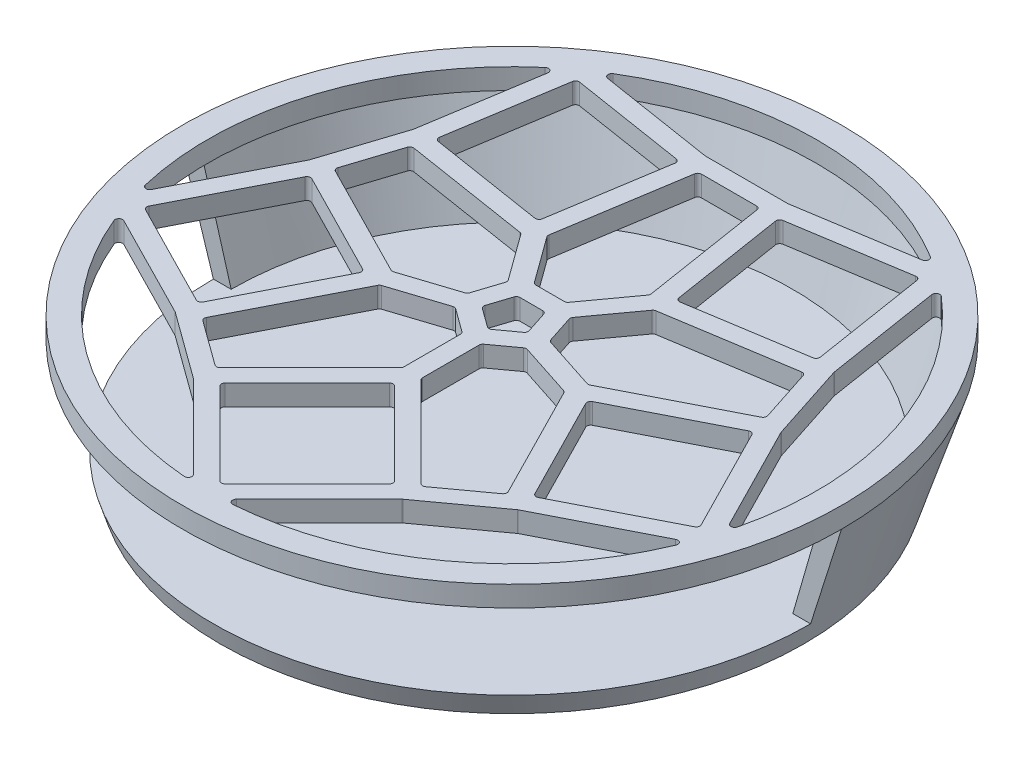
from build123d import *

# Parameters (mm, degrees)
ENL_V_MAT_EXTRU_3_REACH = 66.917
ENL_V_MAT_EXTRU_4_DEPTH = 2.75
ENL_V_MAT_EXTRU_5_DEPTH = 2.75
CONG_2_R                = 0.5


with BuildPart() as part:
    # Esquisse4 → Révolution1 (revolve)
    with BuildSketch(Plane.XY, mode=Mode.PRIVATE) as r_volution1_sk:
        Polygon((0, 0), (-39, 0), (-44, 15.75), (-44, 18.5), (0, 18.5), align=None)
    revolve(r_volution1_sk.sketch.rotate(Axis((0, 0, 0), (0, 1, 0)), 270), axis=Axis((0, 0, 0), (0, 1, 0)))

    # Esquisse5 → Enlèvement de matière-Lissage2 section 0
    with BuildSketch(Plane(origin=(0, 2.75, 0), x_dir=(1, 0, 0), z_dir=(0, 1, 0))):
        with BuildLine():
            Line((44, -44), (-44, -44))
            Line((-44, -44), (-44, 0))
            Line((-44, 0), (-37.5, 0))
            ThreePointArc((-37.5, 0), (0, 37.5), (37.5, 0))
            Line((37.5, 0), (44, 0))
            Line((44, 0), (44, -44))
        make_face()
    # Esquisse6 → Enlèvement de matière-Lissage2 section 1
    with BuildSketch(Plane(origin=(0, 15.75, 0), x_dir=(1, 0, 0), z_dir=(0, 1, 0))):
        with BuildLine():
            Line((-44, -44), (44, -44))
            Line((44, -44), (44, 0))
            Line((44, 0), (41.25, 0))
            ThreePointArc((41.25, 0), (0, 41.25), (-41.25, 0))
            Line((-41.25, 0), (-44, 0))
            Line((-44, 0), (-44, -44))
        make_face()
    loft(mode=Mode.SUBTRACT)

    # Esquisse7 → Enlèv. mat.-Extru.3 (cut, up to next)
    with BuildSketch(Plane(origin=(0, 18.5, 0), x_dir=(1, 0, 0), z_dir=(0, 1, 0)), mode=Mode.PRIVATE) as enl_v_mat_extru_3_sk1:
        Polygon((0, -15.665476221), (-11.66726189, -27.33273811), (0, -39), (11.66726189, -27.33273811), align=None)
    enl_v_mat_extru_3_tool1 = extrude(enl_v_mat_extru_3_sk1.sketch, amount=-ENL_V_MAT_EXTRU_3_REACH, mode=Mode.PRIVATE) & part.part
    # Esquisse7 → Enlèv. mat.-Extru.3 (cut, up to next)
    with BuildSketch(Plane(origin=(0, 18.5, 0), x_dir=(1, 0, 0), z_dir=(0, 1, 0)), mode=Mode.PRIVATE) as enl_v_mat_extru_3_sk2:
        Polygon((-29.60036089, 2.649944868), (-37.091204136, -12.051662781), (-22.389596486, -19.542506026), (-14.898753241, -4.840898377), align=None)
    enl_v_mat_extru_3_tool2 = extrude(enl_v_mat_extru_3_sk2.sketch, amount=-ENL_V_MAT_EXTRU_3_REACH, mode=Mode.PRIVATE) & part.part
    # Esquisse7 → Enlèv. mat.-Extru.3 (cut, up to next)
    with BuildSketch(Plane(origin=(0, 18.5, 0), x_dir=(1, 0, 0), z_dir=(0, 1, 0)), mode=Mode.PRIVATE) as enl_v_mat_extru_3_sk3:
        Polygon((-6.62676722, 28.970494107), (-22.923624839, 31.551662781), (-25.504793513, 15.254805161), (-9.207935893, 12.673636488), align=None)
    enl_v_mat_extru_3_tool3 = extrude(enl_v_mat_extru_3_sk3.sketch, amount=-ENL_V_MAT_EXTRU_3_REACH, mode=Mode.PRIVATE) & part.part
    # Esquisse7 → Enlèv. mat.-Extru.3 (cut, up to next)
    with BuildSketch(Plane(origin=(0, 18.5, 0), x_dir=(1, 0, 0), z_dir=(0, 1, 0)), mode=Mode.PRIVATE) as enl_v_mat_extru_3_sk4:
        Polygon((25.504793513, 15.254805161), (22.923624839, 31.551662781), (6.62676722, 28.970494107), (9.207935893, 12.673636488), align=None)
    enl_v_mat_extru_3_tool4 = extrude(enl_v_mat_extru_3_sk4.sketch, amount=-ENL_V_MAT_EXTRU_3_REACH, mode=Mode.PRIVATE) & part.part
    # Esquisse7 → Enlèv. mat.-Extru.3 (cut, up to next)
    with BuildSketch(Plane(origin=(0, 18.5, 0), x_dir=(1, 0, 0), z_dir=(0, 1, 0)), mode=Mode.PRIVATE) as enl_v_mat_extru_3_sk5:
        Polygon((22.389596486, -19.542506026), (37.091204136, -12.051662781), (29.60036089, 2.649944868), (14.898753241, -4.840898377), align=None)
    enl_v_mat_extru_3_tool5 = extrude(enl_v_mat_extru_3_sk5.sketch, amount=-ENL_V_MAT_EXTRU_3_REACH, mode=Mode.PRIVATE) & part.part
    add(enl_v_mat_extru_3_tool1.solids().sort_by_distance((0, 18.5, 27.332738))[0], mode=Mode.SUBTRACT)
    add(enl_v_mat_extru_3_tool2.solids().sort_by_distance((-25.994979, 18.5, 8.446281))[0], mode=Mode.SUBTRACT)
    add(enl_v_mat_extru_3_tool3.solids().sort_by_distance((-16.06578, 18.5, -22.11265))[0], mode=Mode.SUBTRACT)
    add(enl_v_mat_extru_3_tool4.solids().sort_by_distance((16.06578, 18.5, -22.11265))[0], mode=Mode.SUBTRACT)
    add(enl_v_mat_extru_3_tool5.solids().sort_by_distance((25.994979, 18.5, 8.446281))[0], mode=Mode.SUBTRACT)

    # Esquisse8 → Enlèv. mat.-Extru.4 (cut)
    with BuildSketch(Plane(origin=(0, 18.5, 0), x_dir=(1, 0, 0), z_dir=(0, 1, 0))):
        Polygon((-20.341842754, -21.0302862), (-12.338810083, -5.323450204), (-4.730358107, -2.851313775), (-1.250000499, -5.379942315), (-1.25, -13.379942315), (-13.715015622, -25.844957937), align=None)
        Polygon((-26.286965838, 12.847526272), (-8.875804012, 10.089869151), (-4.17352159, 3.617733489), (-5.502900593, -0.473672484), (-13.111352569, -2.945808914), (-28.818188565, 5.057223757), align=None)
        Polygon((4.095604405, 28.970494107), (6.853261526, 11.559332282), (2.150979912, 5.087196034), (-2.150979104, 5.08719662), (-6.853261526, 11.559332282), (-4.095604405, 28.970494107), align=None)
        Polygon((28.818188565, 5.057223757), (13.111352569, -2.945808914), (5.502900285, -0.473673433), (4.173522397, 3.617732903), (8.875804012, 10.089869151), (26.286965838, 12.847526272), align=None)
        Polygon((13.715015622, -25.844957937), (1.25, -13.379942315), (1.249999501, -5.379942315), (4.730357799, -2.851314724), (12.338810083, -5.323450204), (20.341842754, -21.0302862), align=None)
        with BuildLine():
            Line((-22.307188638, 33.985191692), (-5.512463014, 31.325168474))
            Line((-5.512463014, 31.325168474), (5.512463014, 31.325168474))
            Line((5.512463014, 31.325168474), (22.307188638, 33.985191692))
            ThreePointArc((22.307188638, 33.985191692), (0, 40.652231418), (-22.307188638, 33.985191692))
        make_face()
        with BuildLine():
            Line((31.495450353, 4.43734554), (39.215138402, -10.713395324))
            ThreePointArc((39.215138402, -10.713395324), (38.662569592, 12.562230368), (25.428537631, 31.717398904))
            Line((25.428537631, 31.717398904), (28.088560849, 14.92267328))
            Line((28.088560849, 14.92267328), (31.495450353, 4.43734554))
        make_face()
        with BuildLine():
            Line((13.952795796, -28.58273811), (1.929099768, -40.606434138))
            ThreePointArc((1.929099768, -40.606434138), (23.894782101, -32.888346077), (38.022889178, -14.382761135))
            Line((38.022889178, -14.382761135), (22.872148314, -22.102449184))
            Line((22.872148314, -22.102449184), (13.952795796, -28.58273811))
        make_face()
        with BuildLine():
            Line((-22.872148314, -22.102449184), (-38.022889178, -14.382761135))
            ThreePointArc((-38.022889178, -14.382761135), (-23.894782101, -32.888346077), (-1.929099768, -40.606434138))
            Line((-1.929099768, -40.606434138), (-13.952795796, -28.58273811))
            Line((-13.952795796, -28.58273811), (-22.872148314, -22.102449184))
        make_face()
        with BuildLine():
            Line((-28.088560849, 14.92267328), (-25.428537631, 31.717398904))
            ThreePointArc((-25.428537631, 31.717398904), (-38.662569592, 12.562230368), (-39.215138402, -10.713395324))
            Line((-39.215138402, -10.713395324), (-31.495450353, 4.43734554))
            Line((-31.495450353, 4.43734554), (-28.088560849, 14.92267328))
        make_face()
    extrude(amount=-ENL_V_MAT_EXTRU_4_DEPTH, mode=Mode.SUBTRACT)

    # Esquisse9 → Enlèv. mat.-Extru.5 (cut)
    with BuildSketch(Plane(origin=(0, 18.5, 0), x_dir=(1, 0, 0), z_dir=(0, 1, 0))):
        Polygon((-1.879707807, 2.587196583), (-3.041431826, -0.988220647), (-4.36e-07, -3.197950531), (3.041431557, -0.988221476), (1.879708513, 2.587196071), align=None)
    extrude(amount=-ENL_V_MAT_EXTRU_5_DEPTH, mode=Mode.SUBTRACT)

    # Congé2
    cong_2_edges = [part.edges().sort_by_distance(p)[0] for p in [
        (20.341842754, 17.125, 21.0302862),
        (13.715015622, 17.125, 25.844957937),
        (1.25, 17.125, 13.379942315),
        (1.249999501, 17.125, 5.379942315),
        (4.730357799, 17.125, 2.851314724),
        (12.338810083, 17.125, 5.323450204),
        (31.495450353, 17.125, -4.43734554),
        (28.088560849, 17.125, -14.92267328),
        (25.428537631, 17.125, -31.717398904),
        (39.215138402, 17.125, 10.713395324),
        (13.952795796, 17.125, 28.58273811),
        (22.872148314, 17.125, 22.102449184),
        (38.022889178, 17.125, 14.382761135),
        (1.929099768, 17.125, 40.606434138),
        (-22.872148314, 17.125, 22.102449184),
        (-13.952795796, 17.125, 28.58273811),
        (-1.929099768, 17.125, 40.606434138),
        (-38.022889178, 17.125, 14.382761135),
        (-28.818188565, 17.125, -5.057223757),
        (-26.286965838, 17.125, -12.847526272),
        (-8.875804012, 17.125, -10.089869151),
        (-4.17352159, 17.125, -3.617733489),
        (-5.502900593, 17.125, 0.473672484),
        (-13.111352569, 17.125, 2.945808914),
        (22.307188638, 17.125, -33.985191692),
        (5.512463014, 17.125, -31.325168474),
        (-5.512463014, 17.125, -31.325168474),
        (-22.307188638, 17.125, -33.985191692),
        (26.286965838, 17.125, -12.847526272),
        (28.818188565, 17.125, -5.057223757),
        (13.111352569, 17.125, 2.945808914),
        (5.502900285, 17.125, 0.473673433),
        (4.173522397, 17.125, -3.617732903),
        (8.875804012, 17.125, -10.089869151),
        (-4.095604405, 17.125, -28.970494107),
        (4.095604405, 17.125, -28.970494107),
        (6.853261526, 17.125, -11.559332282),
        (2.150979912, 17.125, -5.087196034),
        (-2.150979104, 17.125, -5.08719662),
        (-6.853261526, 17.125, -11.559332282),
        (-28.088560849, 17.125, -14.92267328),
        (-31.495450353, 17.125, -4.43734554),
        (-39.215138402, 17.125, 10.713395324),
        (-25.428537631, 17.125, -31.717398904),
        (-13.715015622, 17.125, 25.844957937),
        (-20.341842754, 17.125, 21.0302862),
        (-12.338810083, 17.125, 5.323450204),
        (-4.730358107, 17.125, 2.851313775),
        (-1.250000499, 17.125, 5.379942315),
        (-1.25, 17.125, 13.379942315),
        (-1.879707807, 17.125, -2.587196583),
        (1.879708513, 17.125, -2.587196071),
        (3.041431557, 17.125, 0.988221476),
        (-4.36e-07, 17.125, 3.197950531),
        (-3.041431826, 17.125, 0.988220647),
        (22.389596486, 17.125, 19.542506026),
        (37.091204136, 17.125, 12.051662781),
        (29.60036089, 17.125, -2.649944868),
        (14.898753241, 17.125, 4.840898377),
        (25.504793513, 17.125, -15.254805161),
        (22.923624839, 17.125, -31.551662781),
        (6.62676722, 17.125, -28.970494107),
        (9.207935893, 17.125, -12.673636488),
        (-6.62676722, 17.125, -28.970494107),
        (-22.923624839, 17.125, -31.551662781),
        (-25.504793513, 17.125, -15.254805161),
        (-9.207935893, 17.125, -12.673636488),
        (-29.60036089, 17.125, -2.649944868),
        (-37.091204136, 17.125, 12.051662781),
        (-22.389596486, 17.125, 19.542506026),
        (-14.898753241, 17.125, 4.840898377),
        (-11.66726189, 17.125, 27.33273811),
        (0, 17.125, 39),
        (11.66726189, 17.125, 27.33273811),
        (0, 17.125, 15.665476221),
    ]]
    fillet(cong_2_edges, radius=CONG_2_R)


solid = part.part
